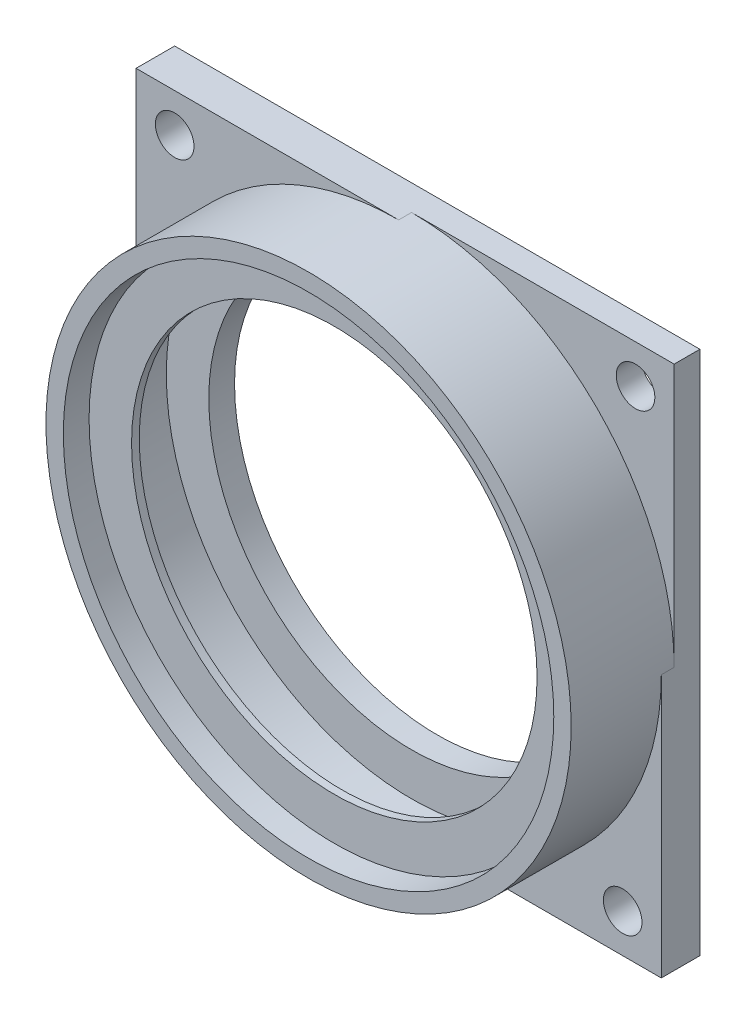
from build123d import *

# Parameters (mm, degrees)
SKETCH2_R               = 20.4
SKETCH2_R_2             = 15.75
SKETCH2_R_3             = 1.5
BOSS_EXTRUDE1_DEPTH     = 5
BOSS_EXTRUDE2_START     = 5
SKETCH2_4_R             = 20.4
SKETCH2_4_R_2           = 15.75
SKETCH2_4_R_3           = 1.5
BOSS_EXTRUDE2_DEPTH     = 6
SKETCH4_R               = 19.05
CUT_EXTRUDE2_DEPTH      = 3
CUT_EXTRUDE3_START      = -6
SKETCH5_R               = 19.05
SKETCH5_R_2             = 15.75
CUT_EXTRUDE3_DEPTH      = 5.4
CUT_EXTRUDE4_START      = -3
CUT_EXTRUDE4_DEPTH      = 3
CUT_EXTRUDE5_START      = -1
SKETCH7_R               = 19.05
CUT_EXTRUDE5_DEPTH      = 1
CUT_EXTRUDE6_DEPTH      = 30.938603842
CUT_EXTRUDE6_DEPTH_BACK = 5


with BuildPart() as part:
    # Sketch2 → Boss-Extrude1 (new body)
    # profile 1 of 5: a face of its own
    with BuildSketch(Plane.XY):
        Circle(SKETCH2_R)
        Circle(SKETCH2_R_2, mode=Mode.SUBTRACT)
    # profile 2 of 5: a face of its own
    with BuildSketch(Plane.XY):
        with BuildLine():
            Line((-20.4, 20.4), (-20.4, -3.8e-08))
            ThreePointArc((-20.4, -3.8e-08), (-14.424978339, 14.424978334), (3.1e-08, 20.4))
            Line((3.1e-08, 20.4), (-20.4, 20.4))
        make_face()
        with Locations((-17.4, 17.4)):
            Circle(SKETCH2_R_3, mode=Mode.SUBTRACT)
    # profile 3 of 5: a face of its own
    with BuildSketch(Plane.XY):
        with BuildLine():
            ThreePointArc((3.1e-08, 20.4), (14.424978347, 14.424978325), (20.4, 0))
            Line((20.4, 0), (20.4, 20.4))
            Line((20.4, 20.4), (3.1e-08, 20.4))
        make_face()
        with Locations((17.4, 17.4)):
            Circle(SKETCH2_R_3, mode=Mode.SUBTRACT)
    # profile 4 of 5: a face of its own
    with BuildSketch(Plane.XY):
        with BuildLine():
            ThreePointArc((20.4, 0), (14.424978335, -14.424978337), (-2e-09, -20.4))
            Line((-2e-09, -20.4), (20.4, -20.4))
            Line((20.4, -20.4), (20.4, 0))
        make_face()
        with Locations((17.4, -17.4)):
            Circle(SKETCH2_R_3, mode=Mode.SUBTRACT)
    # profile 5 of 5: a face of its own
    with BuildSketch(Plane.XY):
        with BuildLine():
            Line((-20.4, -3.8e-08), (-20.4, -20.4))
            Line((-20.4, -20.4), (-2e-09, -20.4))
            ThreePointArc((-2e-09, -20.4), (-14.424978323, -14.424978349), (-20.4, -3.8e-08))
        make_face()
        with Locations((-17.4, -17.4)):
            Circle(SKETCH2_R_3, mode=Mode.SUBTRACT)
    extrude(amount=BOSS_EXTRUDE1_DEPTH)

    # Sketch2<4> → Boss-Extrude2 (add)
    # profile 1 of 3: a face of its own
    with BuildSketch(Plane.XY.offset(BOSS_EXTRUDE2_START)):
        Circle(SKETCH2_4_R)
        Circle(SKETCH2_4_R_2, mode=Mode.SUBTRACT)
    # profile 2 of 3: a face of its own
    with BuildSketch(Plane.XY.offset(BOSS_EXTRUDE2_START)):
        with BuildLine():
            Line((-20.4, 20.4), (-20.4, -3.8e-08))
            ThreePointArc((-20.4, -3.8e-08), (-14.424978339, 14.424978334), (3.1e-08, 20.4))
            Line((3.1e-08, 20.4), (-20.4, 20.4))
        make_face()
        with Locations((-17.4, 17.4)):
            Circle(SKETCH2_4_R_3, mode=Mode.SUBTRACT)
    # profile 3 of 3: a face of its own
    with BuildSketch(Plane.XY.offset(BOSS_EXTRUDE2_START)):
        with BuildLine():
            ThreePointArc((20.4, 0), (14.424978335, -14.424978337), (-2e-09, -20.4))
            Line((-2e-09, -20.4), (20.4, -20.4))
            Line((20.4, -20.4), (20.4, 0))
        make_face()
        with Locations((17.4, -17.4)):
            Circle(SKETCH2_4_R_3, mode=Mode.SUBTRACT)
    extrude(amount=BOSS_EXTRUDE2_DEPTH)

    # Sketch4 → Cut-Extrude2 (cut)
    with BuildSketch(Plane.XY.offset(11)):
        Circle(SKETCH4_R)
    extrude(amount=-CUT_EXTRUDE2_DEPTH, mode=Mode.SUBTRACT)

    # Sketch5 → Cut-Extrude3 (cut)
    with BuildSketch(Plane.XY.offset(8).offset(CUT_EXTRUDE3_START)):
        Circle(SKETCH5_R)
        with Locations(Location((0, 0, 0), (0, 0, 180))):
            Circle(SKETCH5_R_2, mode=Mode.SUBTRACT)
    extrude(amount=CUT_EXTRUDE3_DEPTH, mode=Mode.SUBTRACT)

    # Sketch6 → Cut-Extrude4 (cut)
    with BuildSketch(Plane.XY.offset(5).offset(CUT_EXTRUDE4_START)):
        with BuildLine():
            Line((20.4, 0), (20.4, 20.4))
            Line((20.4, 20.4), (0, 20.4))
            ThreePointArc((0, 20.4), (14.424978336, 14.424978336), (20.4, 0))
        make_face()
        with BuildLine():
            Line((-20.4, 0), (-20.4, -20.4))
            Line((-20.4, -20.4), (0, -20.4))
            ThreePointArc((0, -20.4), (-14.424978336, -14.424978336), (-20.4, 0))
        make_face()
    extrude(amount=CUT_EXTRUDE4_DEPTH, mode=Mode.SUBTRACT)

    # Sketch7 → Cut-Extrude5 (cut)
    with BuildSketch(Plane.XY.offset(11).offset(CUT_EXTRUDE5_START)):
        with BuildLine():
            Line((20.4, -20.4), (20.4, 0))
            ThreePointArc((20.4, 0), (14.424978336, 14.424978336), (0, 20.4))
            Line((0, 20.4), (-20.4, 20.4))
            Line((-20.4, 20.4), (-20.4, 0))
            ThreePointArc((-20.4, 0), (-14.424978336, -14.424978336), (0, -20.4))
            Line((0, -20.4), (20.4, -20.4))
        make_face()
        Circle(SKETCH7_R, mode=Mode.SUBTRACT)
    extrude(amount=CUT_EXTRUDE5_DEPTH, mode=Mode.SUBTRACT)

    # Sketch8 → Cut-Extrude6 (cut, two sides: drawn at the far end of the back side and taken through both)
    with BuildSketch(Plane.XY.offset(8).offset(-CUT_EXTRUDE6_DEPTH_BACK)):
        with BuildLine():
            Line((-20.4, 20.4), (-20.4, 0))
            ThreePointArc((-20.4, 0), (-14.424978336, 14.424978336), (0, 20.4))
            Line((0, 20.4), (-20.4, 20.4))
        make_face()
        with BuildLine():
            ThreePointArc((20.4, 0), (14.424978336, -14.424978336), (0, -20.4))
            Line((0, -20.4), (20.4, -20.4))
            Line((20.4, -20.4), (20.4, 0))
        make_face()
    extrude(amount=CUT_EXTRUDE6_DEPTH + CUT_EXTRUDE6_DEPTH_BACK, mode=Mode.SUBTRACT)


solid = part.part
